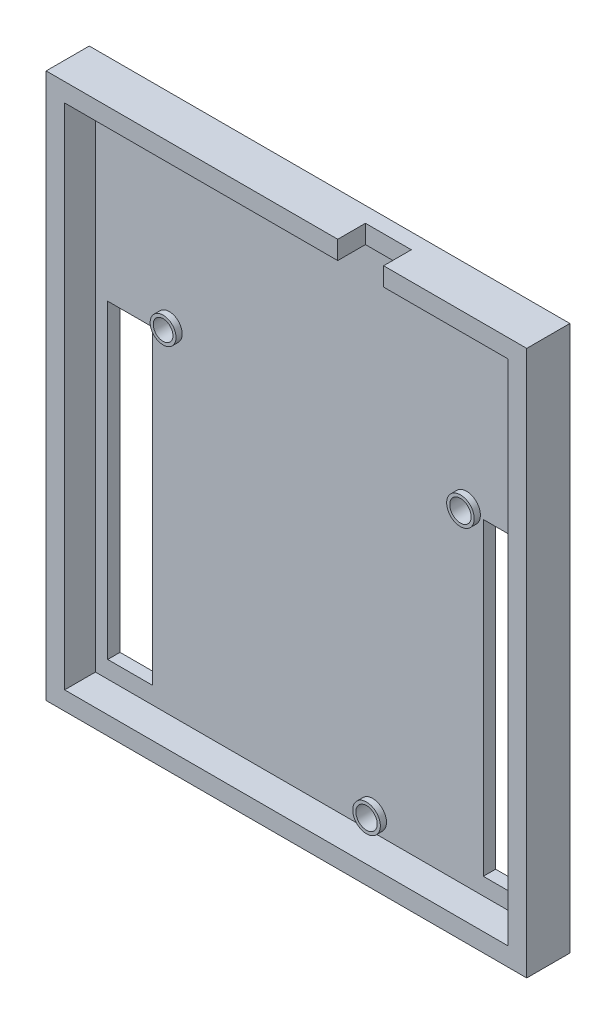
from build123d import *

# Parameters (mm, degrees)
SKETCH1_W           = 78
SKETCH1_H           = 88.5
SKETCH1_W_2         = 72
SKETCH1_H_2         = 82.5
BOSS_EXTRUDE1_DEPTH = 5
SKETCH2_W           = 78
SKETCH2_H           = 88.5
SKETCH2_R           = 1.6
SKETCH2_R_2         = 1.738
BOSS_EXTRUDE2_DEPTH = 2
SKETCH7_W           = 7.279998142
SKETCH7_H           = 50.36
SKETCH7_W_2         = 7.079999996
SKETCH7_H_2         = 50.160000192
CUT_EXTRUDE1_DEPTH  = 15
SKETCH9_W           = 7.45
SKETCH9_H           = 4.497118046
CUT_EXTRUDE7_DEPTH  = 16
SKETCH10_R          = 2.1
SKETCH10_R_2        = 2.238
BOSS_EXTRUDE4_DEPTH = 1
CUT_EXTRUDE8_START  = -15
SKETCH11_R          = 1.738
SKETCH11_R_2        = 1.6
CUT_EXTRUDE8_DEPTH  = 15


with BuildPart() as part:
    # Sketch1 → Boss-Extrude1 (new body)
    with BuildSketch(Plane.XY):
        with Locations((19.784172662, -18.690647482)):
            Rectangle(SKETCH1_W, SKETCH1_H)
        with Locations((19.784172662, -18.690647482)):
            Rectangle(SKETCH1_W_2, SKETCH1_H_2, mode=Mode.SUBTRACT)
    extrude(amount=BOSS_EXTRUDE1_DEPTH)

    # Sketch2 → Boss-Extrude2 (add)
    with BuildSketch(Plane(origin=(0, 0, 0), x_dir=(-1, 0, 0), z_dir=(0, 0, -1))):
        with Locations((-19.784172662, -18.690647482)):
            Rectangle(SKETCH2_W, SKETCH2_H)
        with Locations((4.233803916, -5.370645303)):
            Circle(SKETCH2_R, mode=Mode.SUBTRACT)
        with Locations((-44.026196036, -6.640647161)):
            Circle(SKETCH2_R_2, mode=Mode.SUBTRACT)
        with Locations((-28.78619408, -57.440646574)):
            Circle(SKETCH2_R_2, mode=Mode.SUBTRACT)
    extrude(amount=BOSS_EXTRUDE2_DEPTH)

    # Sketch7 → Cut-Extrude1 (cut)
    with BuildSketch(Plane.XY):
        with Locations((-10.583804942, -31.990645157)):
            Rectangle(SKETCH7_W, SKETCH7_H)
        with Locations((50.276195985, -32.090647407)):
            Rectangle(SKETCH7_W_2, SKETCH7_H_2)
    extrude(amount=-CUT_EXTRUDE1_DEPTH, mode=Mode.SUBTRACT)

    # Sketch9 → Cut-Extrude7 (cut)
    with BuildSketch(Plane.XZ.offset(-22.559352518)):
        with Locations((31.833296536, 2.751440977)):
            Rectangle(SKETCH9_W, SKETCH9_H)
    extrude(amount=-CUT_EXTRUDE7_DEPTH, mode=Mode.SUBTRACT)

    # Sketch10 → Boss-Extrude4 (add)
    with BuildSketch(Plane.XY):
        with Locations(Location((-4.233803916, -5.370645303, 0), (0, 0, 180))):
            Circle(SKETCH10_R)
        with Locations(Location((44.026196036, -6.640647161, 0), (0, 0, 180))):
            Circle(SKETCH10_R_2)
        with Locations(Location((28.78619408, -57.440646574, 0), (0, 0, 180))):
            Circle(SKETCH10_R_2)
    extrude(amount=BOSS_EXTRUDE4_DEPTH)

    # Sketch11 → Cut-Extrude8 (cut)
    with BuildSketch(Plane(origin=(0, 0, 0), x_dir=(-1, 0, 0), z_dir=(0, 0, -1)).offset(CUT_EXTRUDE8_START)):
        with Locations(Location((-44.026196036, -6.640647161, 0), (0, 0, 180))):
            Circle(SKETCH11_R)
        with Locations(Location((4.233803916, -5.370645303, 0), (0, 0, 180))):
            Circle(SKETCH11_R_2)
        with Locations(Location((-28.78619408, -57.440646574, 0), (0, 0, 180))):
            Circle(SKETCH11_R)
    extrude(amount=CUT_EXTRUDE8_DEPTH, mode=Mode.SUBTRACT)


solid = part.part
